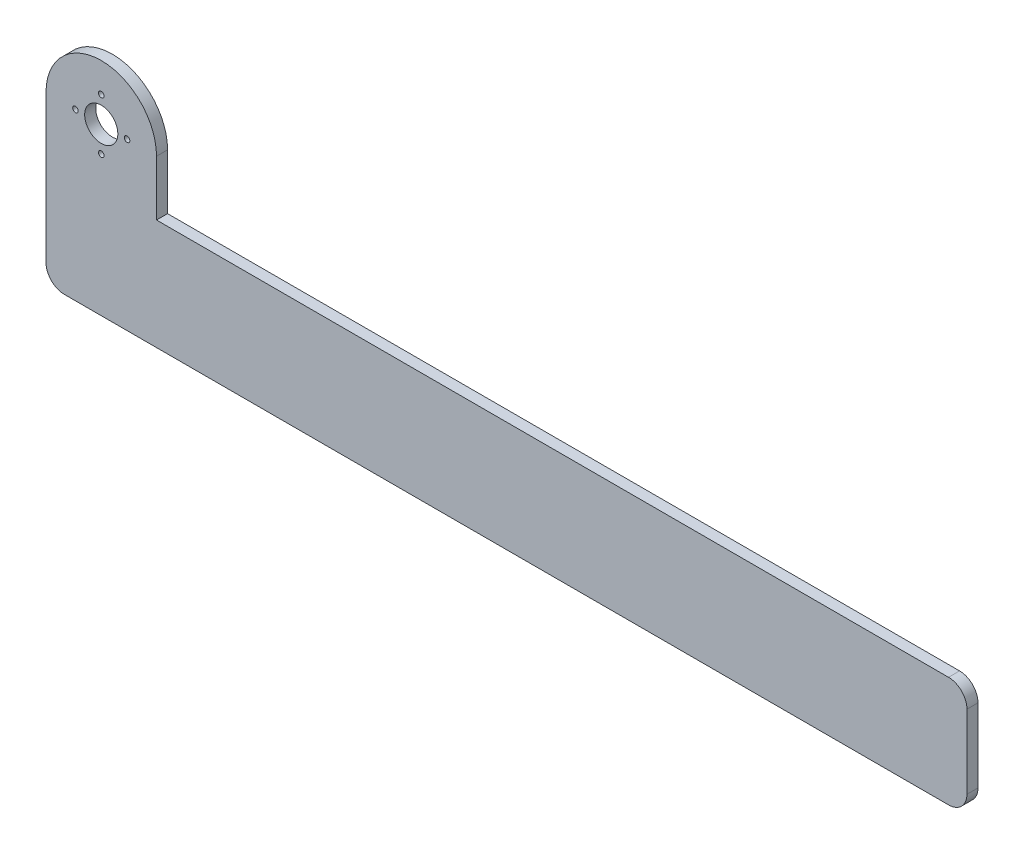
from build123d import *

# Parameters (mm, degrees)
SALIENTE_EXTRUIR1_DEPTH = 6
REDONDEO1_R             = 10
REDONDEO2_R             = 10
CROQUIS2_R              = 9
CORTAR_EXTRUIR1_DEPTH   = 476.984243437
CROQUIS3_R              = 1.5
CORTAR_EXTRUIR2_DEPTH   = 476.984243437


with BuildPart() as part:
    # Croquis1 → Saliente-Extruir1 (new body)
    with BuildSketch(Plane.XY):
        with BuildLine():
            Line((30, -45), (470, -45))
            Line((470, -45), (470, 15))
            Line((470, 15), (30, 15))
            Line((30, 15), (30, 45))
            ThreePointArc((30, 45), (0, 75), (-30, 45))
            Line((-30, 45), (-30, -45))
            Line((-30, -45), (30, -45))
        make_face()
    extrude(amount=SALIENTE_EXTRUIR1_DEPTH)

    # Redondeo1
    redondeo1_edges = [part.edges().sort_by_distance(p)[0] for p in [
        (-30, -45, 3),
    ]]
    fillet(redondeo1_edges, radius=REDONDEO1_R)

    # Redondeo2
    redondeo2_edges = [part.edges().sort_by_distance(p)[0] for p in [
        (470, 15, 3),
        (470, -45, 3),
    ]]
    fillet(redondeo2_edges, radius=REDONDEO2_R)

    # Croquis2 → Cortar-Extruir1 (cut, through all)
    with BuildSketch(Plane.XY.offset(6)):
        with Locations((0, 45)):
            Circle(CROQUIS2_R)
    extrude(amount=-CORTAR_EXTRUIR1_DEPTH, mode=Mode.SUBTRACT)

    # Croquis3 → Cortar-Extruir2 (cut, through all)
    with BuildSketch(Plane.XY.offset(6)):
        with Locations((0, 31)):
            Circle(CROQUIS3_R)
        with Locations((14, 45)):
            Circle(CROQUIS3_R)
        with Locations((0, 59)):
            Circle(CROQUIS3_R)
        with Locations((-14, 45)):
            Circle(CROQUIS3_R)
    extrude(amount=-CORTAR_EXTRUIR2_DEPTH, mode=Mode.SUBTRACT)


solid = part.part
